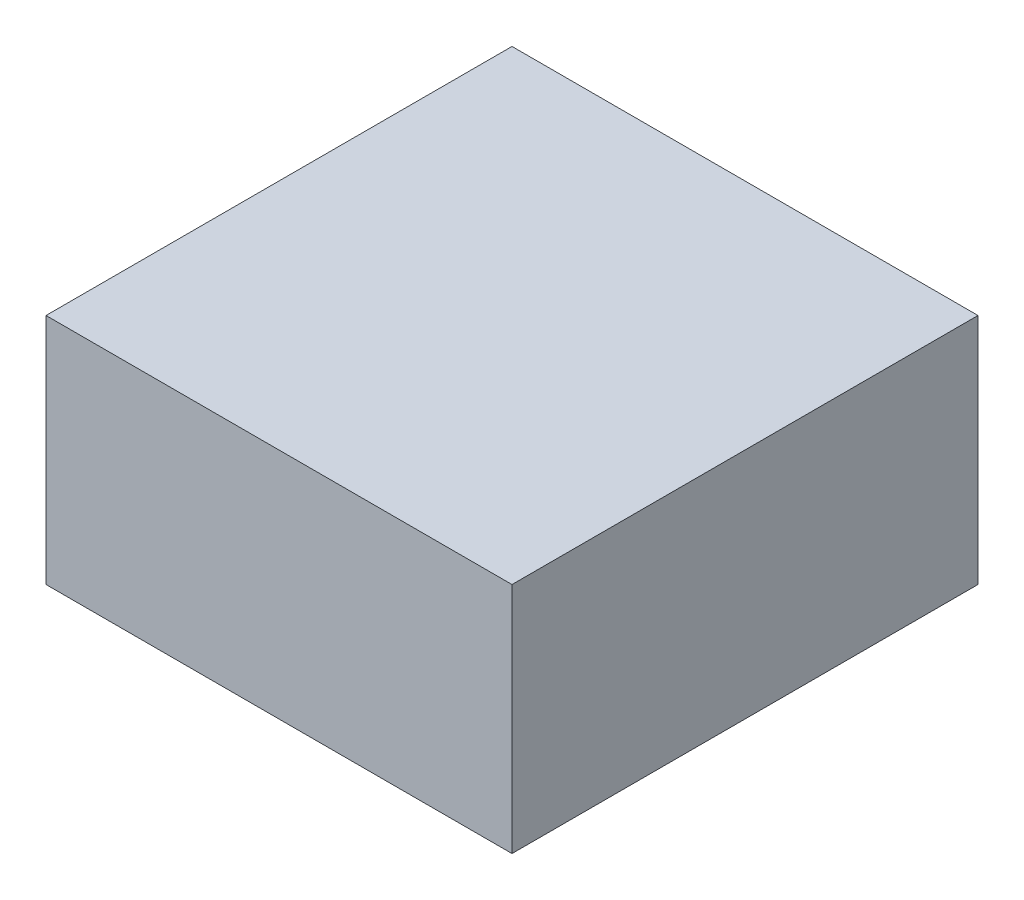
from build123d import *

# Parameters (mm, degrees)
SKETCH1_W           = 3.048
SKETCH1_H           = 1.524
BOSS_EXTRUDE1_DEPTH = 3.048


with BuildPart() as part:
    # Sketch1 → Boss-Extrude1 (new body)
    with BuildSketch(Plane.XY):
        with Locations((1.524, 0.762)):
            Rectangle(SKETCH1_W, SKETCH1_H)
    extrude(amount=BOSS_EXTRUDE1_DEPTH)


solid = part.part
